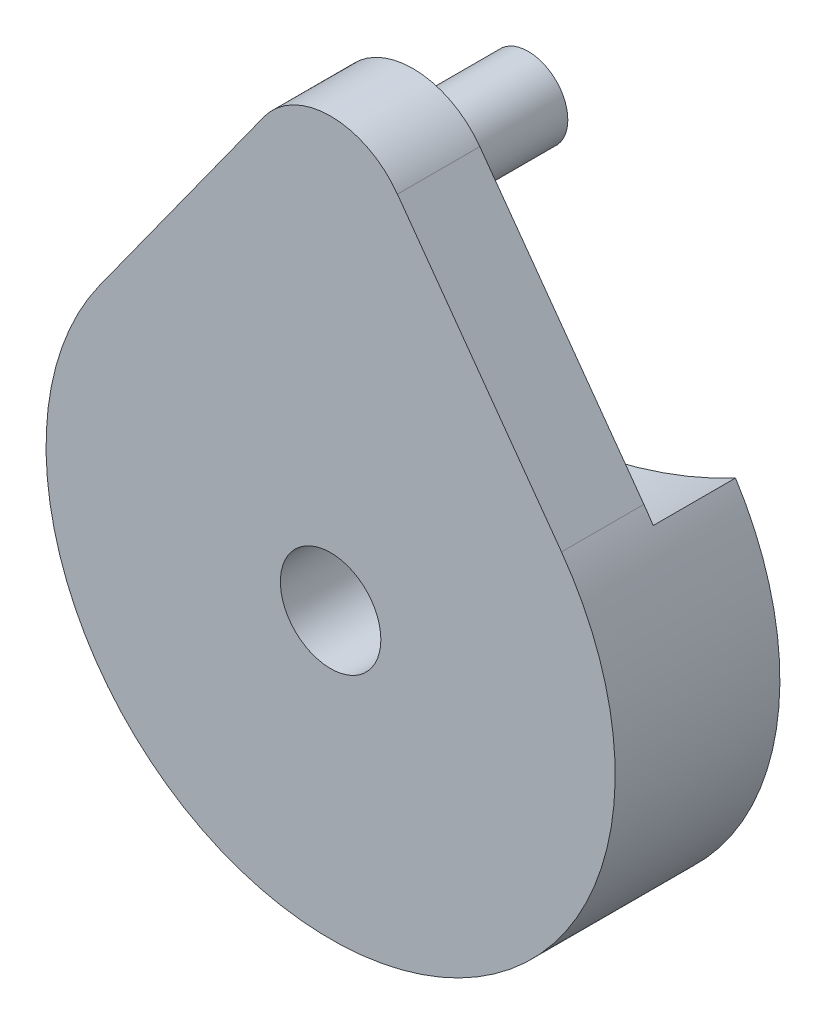
from build123d import *

# Parameters (mm, degrees)
EXTRUDE1_DEPTH      = 2.5
EXTRUDE2_DEPTH      = 5
SKETCH4_R           = 3.05
EXTRUDE4_DEPTH      = 58.470101426
SKETCH5_R           = 2.4
BOSS_EXTRUDE1_DEPTH = 7


with BuildPart() as part:
    # Sketch1 → Extrude1 (new, symmetric)
    with BuildSketch(Plane.XY):
        with BuildLine():
            Line((-14.016148368, -26.524471435), (-4.057181828, -12.697462951))
            ThreePointArc((-4.057181828, -12.697462951), (0, -10.619666847), (4.057181828, -12.697462951))
            Line((4.057181828, -12.697462951), (14.016148368, -26.524471435))
            ThreePointArc((14.016148368, -26.524471435), (0, -53.892923213), (-14.016148368, -26.524471435))
        make_face()
    extrude(amount=EXTRUDE1_DEPTH, both=True)

    # Sketch2 → Extrude2 (add)
    with BuildSketch(Plane(origin=(0, 0, -2.5), x_dir=(-1, 0, 0), z_dir=(0, 0, -1))):
        with BuildLine():
            ThreePointArc((-14.57995219, -27.357357221), (0, -53.892923213), (14.57995219, -27.357357221))
            ThreePointArc((14.57995219, -27.357357221), (0, -31), (-14.57995219, -27.357357221))
        make_face()
    extrude(amount=EXTRUDE2_DEPTH)

    # Sketch4 → Extrude4 (cut, through all)
    with BuildSketch(Plane.XY.offset(2.5)):
        with Locations((0, -36.619666847)):
            Circle(SKETCH4_R)
    extrude(amount=-EXTRUDE4_DEPTH, mode=Mode.SUBTRACT)

    # Sketch5 → Boss-Extrude1 (add)
    with BuildSketch(Plane(origin=(0, 0, -2.5), x_dir=(-1, 0, 0), z_dir=(0, 0, -1))):
        with Locations(Location((0, -15.619666847, 0), (0, 0, 180))):
            Circle(SKETCH5_R)
    extrude(amount=BOSS_EXTRUDE1_DEPTH)


solid = part.part
